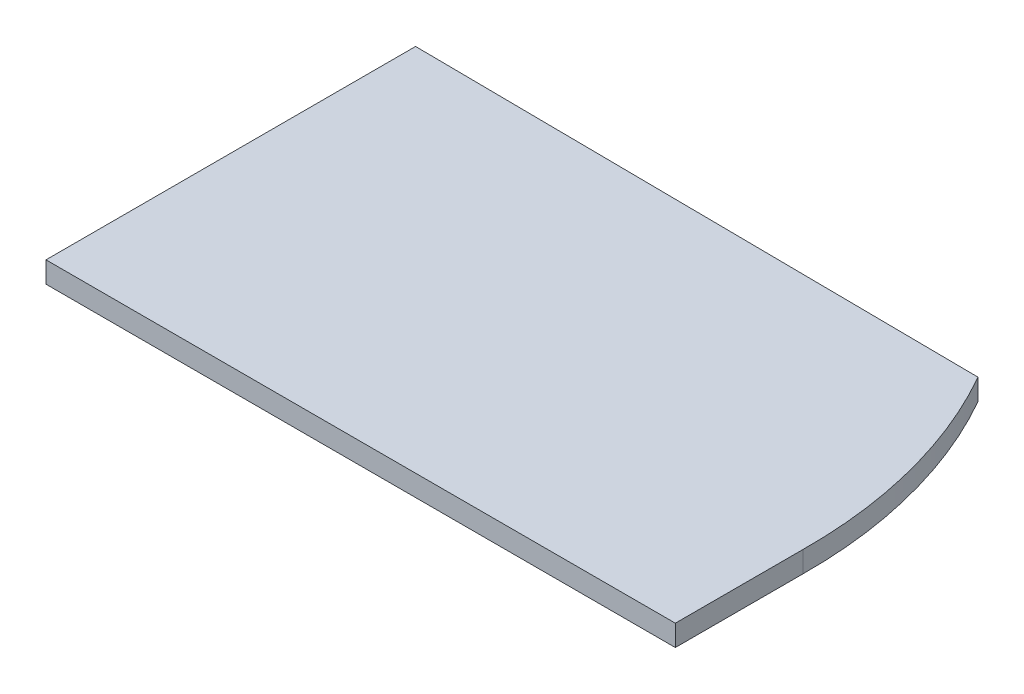
from build123d import *

# Parameters (mm, degrees)
BOSS_EXTRUDE1_DEPTH = 10


with BuildPart() as part:
    # Sketch1 → Boss-Extrude1 (new body)
    with BuildSketch(Plane(origin=(0, 0, 0), x_dir=(1, 0, 0), z_dir=(0, 1, 0))):
        with BuildLine():
            Line((0, 0), (298, 0))
            Line((298, 0), (298, 60.409420436))
            ThreePointArc((298, 60.409420436), (290.822626954, 118.412368536), (268.77470107, 172.53949331))
            Line((268.77470107, 172.53949331), (0, 175))
            Line((0, 175), (0, 0))
        make_face()
    extrude(amount=BOSS_EXTRUDE1_DEPTH)


solid = part.part
